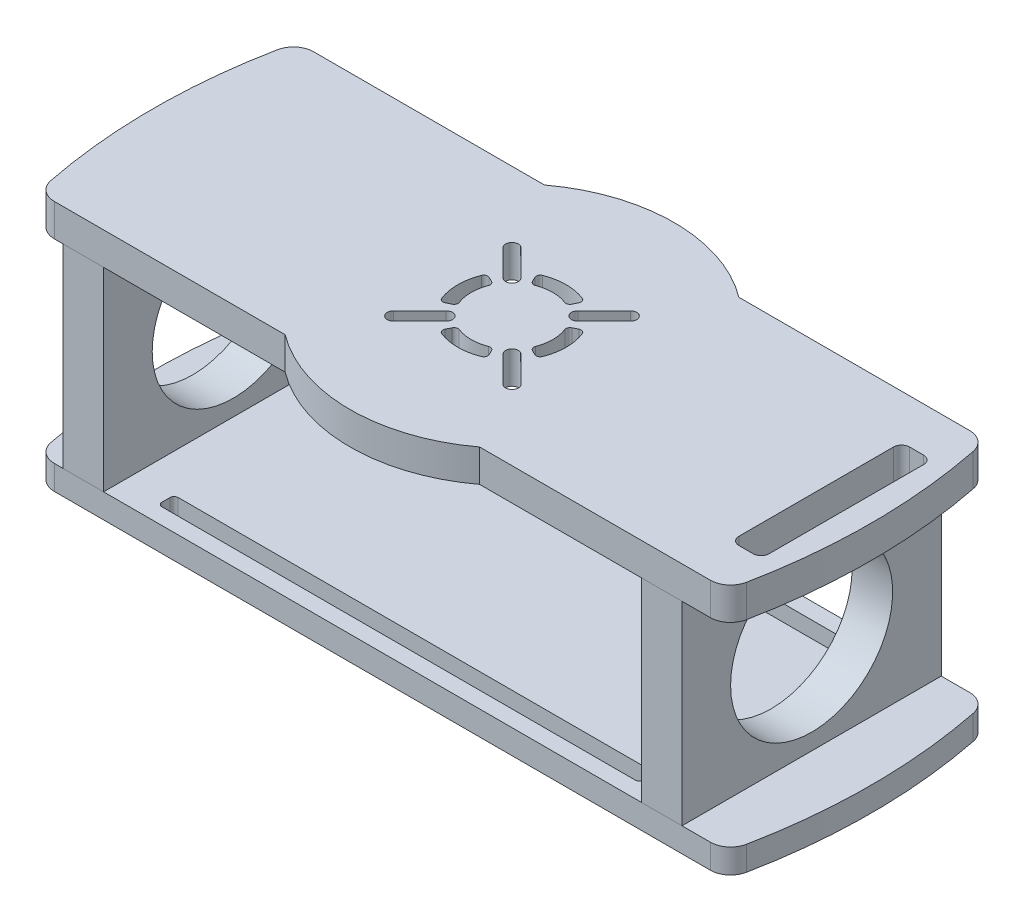
from build123d import *

# Parameters (mm, degrees)
SKETCH3_W             = 3.734694983
SKETCH3_H             = 21.06352889
BOSS_EXTRUDE1_DEPTH   = 4
SKETCH4_W             = 5
SKETCH4_H             = 32
BOSS_EXTRUDE2_DEPTH   = 24
BOSS_EXTRUDE2_2_DEPTH = 24
BOSS_EXTRUDE3_DEPTH   = 3
CUT_EXTRUDE1_DEPTH    = 3
FILLET3_R             = 2.5
FILLET4_R             = 2.5
FILLET5_R             = 1
CUT_EXTRUDE2_DEPTH    = 4
CUT_EXTRUDE3_START    = -76.384302
SKETCH8_R             = 10
CUT_EXTRUDE3_DEPTH    = 76.384302


with BuildPart() as part:
    # Sketch3 → Boss-Extrude1 (new body)
    with BuildSketch(Plane(origin=(0, 0, 0), x_dir=(1, 0, 0), z_dir=(0, 1, 0))):
        with BuildLine():
            Line((-12, -16), (-42.5, -16))
            ThreePointArc((-42.5, -16), (-44.311632106, 0), (-42.5, 16))
            Line((-42.5, 16), (-12, 16))
            ThreePointArc((-12, 16), (0, 20), (12, 16))
            Line((12, 16), (42.5, 16))
            ThreePointArc((42.5, 16), (44.311632106, 0), (42.5, -16))
            Line((42.5, -16), (12, -16))
            ThreePointArc((12, -16), (0, -20), (-12, -16))
        make_face()
        with Locations((39.411338735, 0)):
            Rectangle(SKETCH3_W, SKETCH3_H, mode=Mode.SUBTRACT)
    extrude(amount=BOSS_EXTRUDE1_DEPTH)

    # Fillet4
    fillet4_edges = [part.edges().sort_by_distance(p)[0] for p in [
        (-42.5, 2, -16),
        (42.5, 2, -16),
        (42.5, 2, 16),
        (-42.5, 2, 16),
    ]]
    fillet(fillet4_edges, radius=FILLET4_R)

    # Fillet5
    fillet5_edges = [part.edges().sort_by_distance(p)[0] for p in [
        (41.278686226, 2, 10.531764445),
        (41.278686226, 2, -10.531764445),
        (37.543991243, 2, -10.531764445),
        (37.543991243, 2, 10.531764445),
    ]]
    fillet(fillet5_edges, radius=FILLET5_R)

    # Sketch7 → Cut-Extrude2 (cut)
    with BuildSketch(Plane(origin=(0, 4, 0), x_dir=(1, 0, 0), z_dir=(0, 1, 0))):
        with BuildLine():
            Line((4.614223874, -3.509411454), (7.857111921, -6.752299502))
            ThreePointArc((7.857111921, -6.752299502), (7.857111921, -7.857111921), (6.752299502, -7.857111921))
            Line((6.752299502, -7.857111921), (3.509411454, -4.614223874))
            ThreePointArc((3.509411454, -4.614223874), (3.509411454, -3.509411454), (4.614223874, -3.509411454))
        make_face()
        with BuildLine():
            Line((-2.432634641, 4.953953344), (-2.720178393, 5.539523536))
            ThreePointArc((-2.720178393, 5.539523536), (-2.73764907, 5.940419304), (-2.454793449, 6.225051239))
            ThreePointArc((-2.454793449, 6.225051239), (-0.000193165, 6.691582307), (2.45443405, 6.225192953))
            ThreePointArc((2.45443405, 6.225192953), (2.737306103, 5.940577348), (2.719858572, 5.539680573))
            Line((2.719858572, 5.539680573), (2.432348627, 4.954093781))
            ThreePointArc((2.432348627, 4.954093781), (2.166276684, 4.709049338), (1.804560078, 4.707581634))
            ThreePointArc((1.804560078, 4.707581634), (-0.000145535, 5.041603108), (-1.804831861, 4.707477443))
            ThreePointArc((-1.804831861, 4.707477443), (-2.166548551, 4.708924263), (-2.432634641, 4.953953344))
        make_face()
        with BuildLine():
            Line((4.953953344, 2.432634641), (5.539523536, 2.720178393))
            ThreePointArc((5.539523536, 2.720178393), (5.940419304, 2.73764907), (6.225051239, 2.454793449))
            ThreePointArc((6.225051239, 2.454793449), (6.691582307, 0.000193165), (6.225192953, -2.45443405))
            ThreePointArc((6.225192953, -2.45443405), (5.940577348, -2.737306103), (5.539680573, -2.719858572))
            Line((5.539680573, -2.719858572), (4.954093781, -2.432348627))
            ThreePointArc((4.954093781, -2.432348627), (4.709049338, -2.166276684), (4.707581634, -1.804560078))
            ThreePointArc((4.707581634, -1.804560078), (5.041603108, 0.000145535), (4.707477443, 1.804831861))
            ThreePointArc((4.707477443, 1.804831861), (4.708924263, 2.166548551), (4.953953344, 2.432634641))
        make_face()
        with BuildLine():
            Line((2.432634641, -4.953953344), (2.720178393, -5.539523536))
            ThreePointArc((2.720178393, -5.539523536), (2.73764907, -5.940419304), (2.454793449, -6.225051239))
            ThreePointArc((2.454793449, -6.225051239), (0.000193165, -6.691582307), (-2.45443405, -6.225192953))
            ThreePointArc((-2.45443405, -6.225192953), (-2.737306103, -5.940577348), (-2.719858572, -5.539680573))
            Line((-2.719858572, -5.539680573), (-2.432348627, -4.954093781))
            ThreePointArc((-2.432348627, -4.954093781), (-2.166276684, -4.709049338), (-1.804560078, -4.707581634))
            ThreePointArc((-1.804560078, -4.707581634), (0.000145535, -5.041603108), (1.804831861, -4.707477443))
            ThreePointArc((1.804831861, -4.707477443), (2.166548551, -4.708924263), (2.432634641, -4.953953344))
        make_face()
        with BuildLine():
            Line((-4.953953344, -2.432634641), (-5.539523536, -2.720178393))
            ThreePointArc((-5.539523536, -2.720178393), (-5.940419304, -2.73764907), (-6.225051239, -2.454793449))
            ThreePointArc((-6.225051239, -2.454793449), (-6.691582307, -0.000193165), (-6.225192953, 2.45443405))
            ThreePointArc((-6.225192953, 2.45443405), (-5.940577348, 2.737306103), (-5.539680573, 2.719858572))
            Line((-5.539680573, 2.719858572), (-4.954093781, 2.432348627))
            ThreePointArc((-4.954093781, 2.432348627), (-4.709049338, 2.166276684), (-4.707581634, 1.804560078))
            ThreePointArc((-4.707581634, 1.804560078), (-5.041603108, -0.000145535), (-4.707477443, -1.804831861))
            ThreePointArc((-4.707477443, -1.804831861), (-4.708924263, -2.166548551), (-4.953953344, -2.432634641))
        make_face()
        with BuildLine():
            Line((3.509411454, 4.614223874), (6.752299502, 7.857111921))
            ThreePointArc((6.752299502, 7.857111921), (7.857111921, 7.857111921), (7.857111921, 6.752299502))
            Line((7.857111921, 6.752299502), (4.614223874, 3.509411454))
            ThreePointArc((4.614223874, 3.509411454), (3.509411454, 3.509411454), (3.509411454, 4.614223874))
        make_face()
        with BuildLine():
            Line((-3.509411454, -4.614223874), (-6.752299502, -7.857111921))
            ThreePointArc((-6.752299502, -7.857111921), (-7.857111921, -7.857111921), (-7.857111921, -6.752299502))
            Line((-7.857111921, -6.752299502), (-4.614223874, -3.509411454))
            ThreePointArc((-4.614223874, -3.509411454), (-3.509411454, -3.509411454), (-3.509411454, -4.614223874))
        make_face()
        with BuildLine():
            Line((-4.614223874, 3.509411454), (-7.857111921, 6.752299502))
            ThreePointArc((-7.857111921, 6.752299502), (-7.857111921, 7.857111921), (-6.752299502, 7.857111921))
            Line((-6.752299502, 7.857111921), (-3.509411454, 4.614223874))
            ThreePointArc((-3.509411454, 4.614223874), (-3.509411454, 3.509411454), (-4.614223874, 3.509411454))
        make_face()
    extrude(amount=-CUT_EXTRUDE2_DEPTH, mode=Mode.SUBTRACT)


with BuildPart() as body_2:
    # Sketch4 → Boss-Extrude2 (new body)
    with BuildSketch(Plane.XZ):
        with Locations((-36.904713213, 0)):
            Rectangle(SKETCH4_W, SKETCH4_H)
    extrude(amount=BOSS_EXTRUDE2_DEPTH)


with BuildPart() as body_3:
    # Sketch4 → Boss-Extrude2 2 (new body)
    with BuildSketch(Plane.XZ):
        with Locations((34.479588459, 0)):
            Rectangle(SKETCH4_W, SKETCH4_H)
    extrude(amount=BOSS_EXTRUDE2_2_DEPTH)


with BuildPart() as body_4:
    # Sketch5 → Boss-Extrude3 (new body)
    with BuildSketch(Plane.XZ.offset(24)):
        with BuildLine():
            Line((-12, 16), (12, 16))
            Line((12, 16), (42.5, 16))
            ThreePointArc((42.5, 16), (44.311632106, 0), (42.5, -16))
            Line((42.5, -16), (12, -16))
            Line((12, -16), (-12, -16))
            Line((-12, -16), (-42.5, -16))
            ThreePointArc((-42.5, -16), (-44.311632106, 0), (-42.5, 16))
            Line((-42.5, 16), (-12, 16))
        make_face()
    extrude(amount=BOSS_EXTRUDE3_DEPTH)

    # Sketch6 → Cut-Extrude1 (cut)
    with BuildSketch(Plane.XZ.offset(27)):
        with BuildLine():
            Line((-29.199625594, -12), (29.199625594, -12))
            ThreePointArc((29.199625594, -12), (29.553178985, -12.146446609), (29.699625594, -12.5))
            Line((29.699625594, -12.5), (29.699625594, -13.5))
            ThreePointArc((29.699625594, -13.5), (29.553178985, -13.853553391), (29.199625594, -14))
            Line((29.199625594, -14), (-29.199625594, -14))
            ThreePointArc((-29.199625594, -14), (-29.553178985, -13.853553391), (-29.699625594, -13.5))
            Line((-29.699625594, -13.5), (-29.699625594, -12.5))
            ThreePointArc((-29.699625594, -12.5), (-29.553178985, -12.146446609), (-29.199625594, -12))
        make_face()
        with BuildLine():
            Line((-29.199625594, 14), (29.199625594, 14))
            ThreePointArc((29.199625594, 14), (29.553178985, 13.853553391), (29.699625594, 13.5))
            Line((29.699625594, 13.5), (29.699625594, 12.5))
            ThreePointArc((29.699625594, 12.5), (29.553178985, 12.146446609), (29.199625594, 12))
            Line((29.199625594, 12), (-29.199625594, 12))
            ThreePointArc((-29.199625594, 12), (-29.553178985, 12.146446609), (-29.699625594, 12.5))
            Line((-29.699625594, 12.5), (-29.699625594, 13.5))
            ThreePointArc((-29.699625594, 13.5), (-29.553178985, 13.853553391), (-29.199625594, 14))
        make_face()
    extrude(amount=-CUT_EXTRUDE1_DEPTH, mode=Mode.SUBTRACT)

    # Fillet3
    fillet3_edges = [body_4.edges().sort_by_distance(p)[0] for p in [
        (-42.5, -25.5, 16),
        (42.5, -25.5, 16),
        (42.5, -25.5, -16),
        (-42.5, -25.5, -16),
    ]]
    fillet(fillet3_edges, radius=FILLET3_R)


with BuildPart() as cut_extrude3_tool:
    # Sketch8 → Cut-Extrude3 (new body)
    with BuildSketch(Plane.ZY.offset(39.404713213).offset(CUT_EXTRUDE3_START)):
        with Locations((0, -12)):
            Circle(SKETCH8_R)
    extrude(amount=CUT_EXTRUDE3_DEPTH)


with BuildPart() as body_2_1:
    add(body_2.part)

    # Cut-Extrude3: cut by cut_extrude3_tool
    add(cut_extrude3_tool.part, mode=Mode.SUBTRACT)


with BuildPart() as body_3_1:
    add(body_3.part)

    # Cut-Extrude3: cut by cut_extrude3_tool
    add(cut_extrude3_tool.part, mode=Mode.SUBTRACT)


solid = Compound([part.part, body_4.part, body_2_1.part, body_3_1.part])
